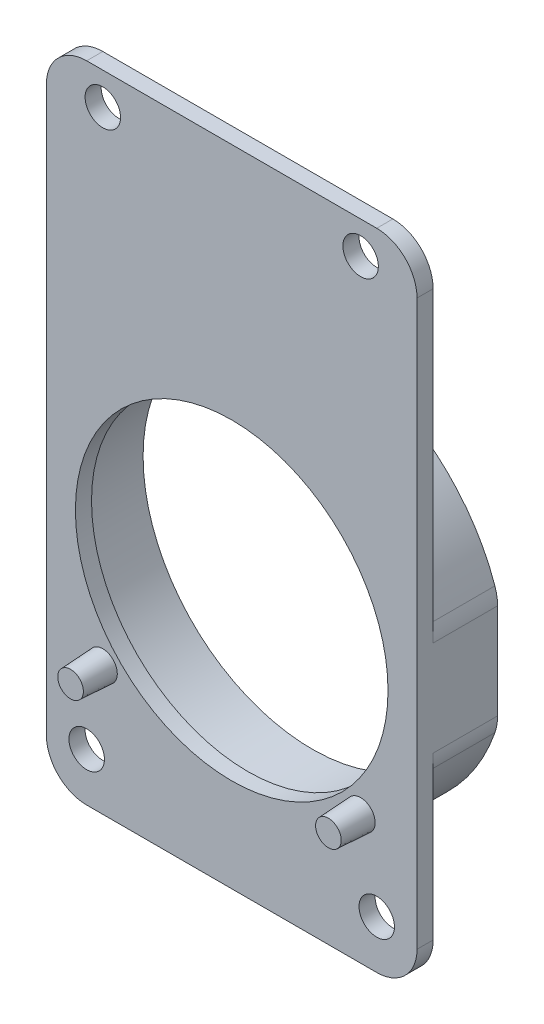
from build123d import *

# Parameters (mm, degrees)
SKETCH_1_W                = 23
SKETCH_1_H                = 40
EXTRUDE_1_DEPTH           = 1
SKETCH_2_R                = 9.7
CUT_EXTRUDE_1_DEPTH       = 28.083205128
FILLET_1_R                = 2.5
HOLE_WIZARD_M2_1_D        = 2.2
SKETCH_7_R                = 0.9
EXTRUDE_2_DEPTH           = 2
EXTRUDE_2_DRAFT           = 3
EXTRUDE_2_PROFILE_2_DEPTH = 2
EXTRUDE_2_PROFILE_2_DRAFT = 3
SKETCH_8_R                = 10.5
EXTRUDE_3_DEPTH           = 4
FILLET_2_R                = 3


with BuildPart() as part:
    # 草图1 → 凸台-拉伸1 (new body)
    with BuildSketch(Plane.XY):
        with Locations((0, 4.5)):
            Rectangle(SKETCH_1_W, SKETCH_1_H)
    extrude(amount=EXTRUDE_1_DEPTH)

    # 草图2 → 切除-拉伸1 (cut, through all)
    with BuildSketch(Plane.XY.offset(1)):
        Circle(SKETCH_2_R)
    extrude(amount=-CUT_EXTRUDE_1_DEPTH, mode=Mode.SUBTRACT)

    # 圆角1
    fillet_1_edges = [part.edges().sort_by_distance(p)[0] for p in [
        (-11.5, 24.5, 0.5),
        (11.5, 24.5, 0.5),
        (11.5, -15.5, 0.5),
        (-11.5, -15.5, 0.5),
    ]]
    fillet(fillet_1_edges, radius=FILLET_1_R)

    # M2 间隙孔1 (through all)
    with Locations(Plane.XY.offset(1)):
        with Locations((-8, 22.5), (8, 22.5), (-9, -12.5), (9, -12.5)):
            Hole(HOLE_WIZARD_M2_1_D / 2)


with BuildPart() as extrude_2_tool:
    # 草图7 → 凸台-拉伸2 (with draft: the straight prism first)
    with BuildSketch(Plane.XY.offset(1)):
        with Locations((-8, -7.5)):
            Circle(SKETCH_7_R)
    extrude(amount=EXTRUDE_2_DEPTH)
    # 凸台-拉伸2: the draft: its side faces are tilted about the plane it starts from
    extrude_2_sides = [extrude_2_tool.faces().sort_by_distance(p)[0] for p in [
        (-8.9, -7.5, 2),
    ]]
    draft(extrude_2_sides, Plane.XY.offset(1), EXTRUDE_2_DRAFT)


with BuildPart() as part_1:
    add(part.part)

    # 凸台-拉伸2: add extrude_2_tool
    add(extrude_2_tool.part)


with BuildPart() as extrude_2_profile_2_tool:
    # 草图7 → 凸台-拉伸2 profile 2 (with draft: the straight prism first)
    with BuildSketch(Plane.XY.offset(1)):
        with Locations((8, -7.5)):
            Circle(SKETCH_7_R)
    extrude(amount=EXTRUDE_2_PROFILE_2_DEPTH)
    # 凸台-拉伸2 profile 2: the draft: its side faces are tilted about the plane it starts from
    extrude_2_profile_2_sides = [extrude_2_profile_2_tool.faces().sort_by_distance(p)[0] for p in [
        (7.1, -7.5, 2),
    ]]
    draft(extrude_2_profile_2_sides, Plane.XY.offset(1), EXTRUDE_2_PROFILE_2_DRAFT)


with BuildPart() as part_2:
    add(part_1.part)

    # 凸台-拉伸2 profile 2: add extrude_2_profile_2_tool
    add(extrude_2_profile_2_tool.part)

    # 草图8 → 凸台-拉伸3 (add)
    with BuildSketch(Plane(origin=(0, 0, 0), x_dir=(-1, 0, 0), z_dir=(0, 0, -1))):
        with BuildLine():
            Line((11.5, 3.4278273), (11.5, -3.4278273))
            ThreePointArc((11.5, -3.4278273), (0, -12), (-11.5, -3.4278273))
            Line((-11.5, -3.4278273), (-11.5, 3.4278273))
            ThreePointArc((-11.5, 3.4278273), (0, 12), (11.5, 3.4278273))
        make_face()
        Circle(SKETCH_8_R, mode=Mode.SUBTRACT)
    extrude(amount=EXTRUDE_3_DEPTH)

    # 圆角2
    fillet_2_edges = [part_2.edges().sort_by_distance(p)[0] for p in [
        (-11.5, -3.4278273, -2),
        (-11.5, 3.4278273, -2),
        (11.5, -3.4278273, -2),
        (11.5, 3.4278273, -2),
    ]]
    fillet(fillet_2_edges, radius=FILLET_2_R)


solid = part_2.part
